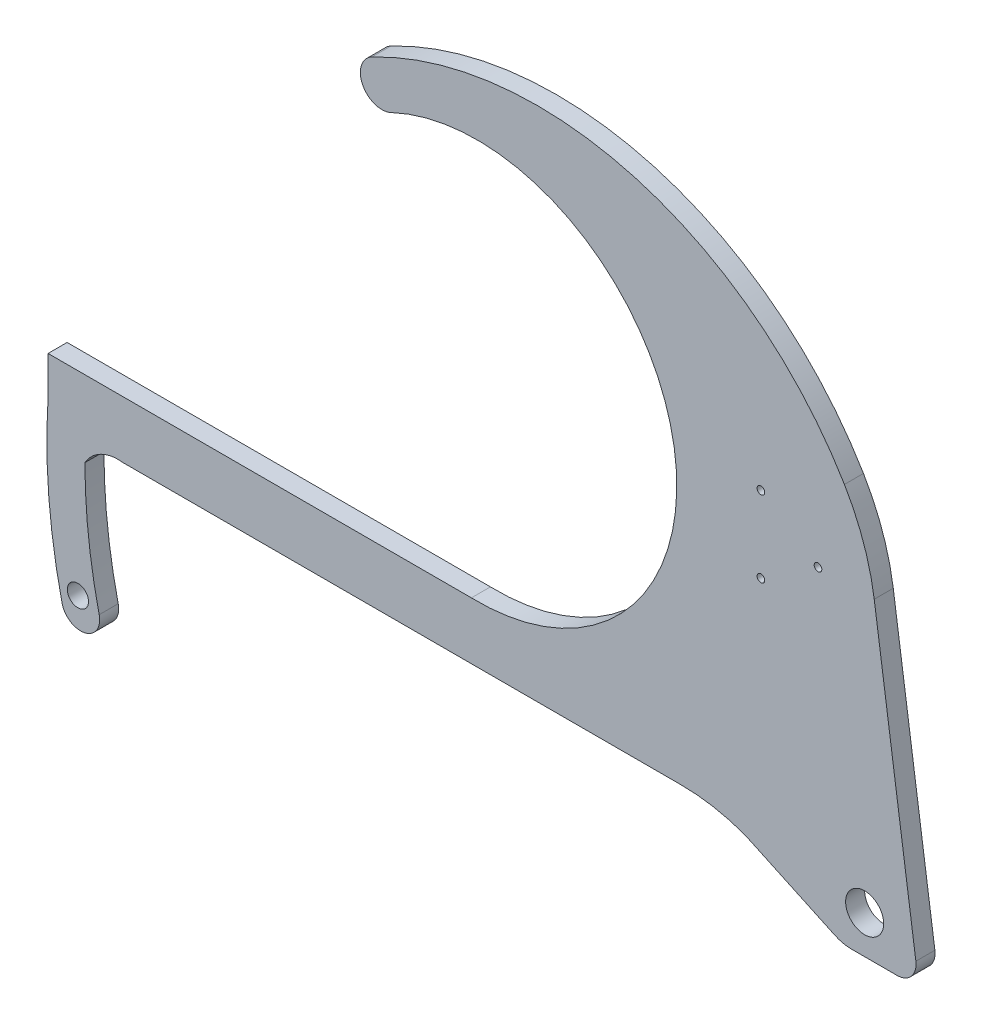
from build123d import *

# Parameters (mm, degrees)
SKETCH12_R          = 3.534772165
SKETCH12_R_2        = 6.35
BOSS_EXTRUDE1_DEPTH = 6.35
FILLET1_R           = 76.2
CUT_EXTRUDE1_REACH  = 328.259
SKETCH13_R          = 1.27


with BuildPart() as part:
    # Sketch12 → Boss-Extrude1 (new body)
    with BuildSketch(Plane.XY):
        with BuildLine():
            Line((-39.821029206, 2.474307267), (-9.831351966, -11.510108895))
            ThreePointArc((-9.831351966, -11.510108895), (-7.212883139, -12.39895929), (-4.464100042, -12.7))
            Line((-4.464100042, -12.7), (10.803041567, -12.7))
            ThreePointArc((10.803041567, -12.7), (15.59897105, -10.511917874), (17.089739091, -5.455609571))
            Line((17.089739091, -5.455609571), (1.595718556, 103.452331978))
            ThreePointArc((1.595718556, 103.452331978), (-67.699436665, 171.237030889), (-164.440692675, 165.095912987))
            ThreePointArc((-164.440692675, 165.095912987), (-167.534473509, 155.523319718), (-158.02225004, 152.248624859))
            ThreePointArc((-158.02225004, 152.248624859), (-64.124270807, 105.829190753), (-131.226727106, 25.4))
            Line((-131.226727106, 25.4), (-272.4912, 25.4))
            Line((-272.4912, 25.4), (-272.4912, 12.7))
            ThreePointArc((-272.4912, 12.7), (-272.246013191, -16.046367487), (-267.813472119, -44.45))
            ThreePointArc((-267.813472119, -44.45), (-260.190367935, -49.202291704), (-255.438076231, -41.579187519))
            ThreePointArc((-255.438076231, -41.579187519), (-259.003846596, -20.925354843), (-260.1976, 0))
            ThreePointArc((-260.1976, 0), (-254.817926624, 5.115653247), (-247.4976, 6.35))
            Line((-247.4976, 6.35), (-61.685028221, 6.35))
            ThreePointArc((-61.685028221, 6.35), (-50.5754306, 5.414040325), (-39.821029206, 2.474307267))
        make_face()
        with Locations((-262.5344, -39.5986)):
            Circle(SKETCH12_R, mode=Mode.SUBTRACT)
        Circle(SKETCH12_R_2, mode=Mode.SUBTRACT)
    extrude(amount=BOSS_EXTRUDE1_DEPTH)

    # Fillet1
    fillet1_edges = [part.edges().sort_by_distance(p)[0] for p in [
        (1.595718556, 103.452331978, 3.175),
    ]]
    fillet(fillet1_edges, radius=FILLET1_R)

    # Sketch13 → Cut-Extrude1 (cut, up to next)
    with BuildSketch(Plane.XY.offset(6.35), mode=Mode.PRIVATE) as cut_extrude1_sk1:
        with Locations((-15.567641436, 92.075)):
            Circle(SKETCH13_R)
    cut_extrude1_tool1 = extrude(cut_extrude1_sk1.sketch, amount=-CUT_EXTRUDE1_REACH, mode=Mode.PRIVATE) & part.part
    # Sketch13 → Cut-Extrude1 (cut, up to next)
    with BuildSketch(Plane.XY.offset(6.35), mode=Mode.PRIVATE) as cut_extrude1_sk2:
        with Locations((-34.617641436, 104.775)):
            Circle(SKETCH13_R)
    cut_extrude1_tool2 = extrude(cut_extrude1_sk2.sketch, amount=-CUT_EXTRUDE1_REACH, mode=Mode.PRIVATE) & part.part
    # Sketch13 → Cut-Extrude1 (cut, up to next)
    with BuildSketch(Plane.XY.offset(6.35), mode=Mode.PRIVATE) as cut_extrude1_sk3:
        with Locations((-34.617641436, 79.375)):
            Circle(SKETCH13_R)
    cut_extrude1_tool3 = extrude(cut_extrude1_sk3.sketch, amount=-CUT_EXTRUDE1_REACH, mode=Mode.PRIVATE) & part.part
    add(cut_extrude1_tool1.solids().sort_by_distance((-15.567641, 92.075, 6.35))[0], mode=Mode.SUBTRACT)
    add(cut_extrude1_tool2.solids().sort_by_distance((-34.617641, 104.775, 6.35))[0], mode=Mode.SUBTRACT)
    add(cut_extrude1_tool3.solids().sort_by_distance((-34.617641, 79.375, 6.35))[0], mode=Mode.SUBTRACT)


solid = part.part
